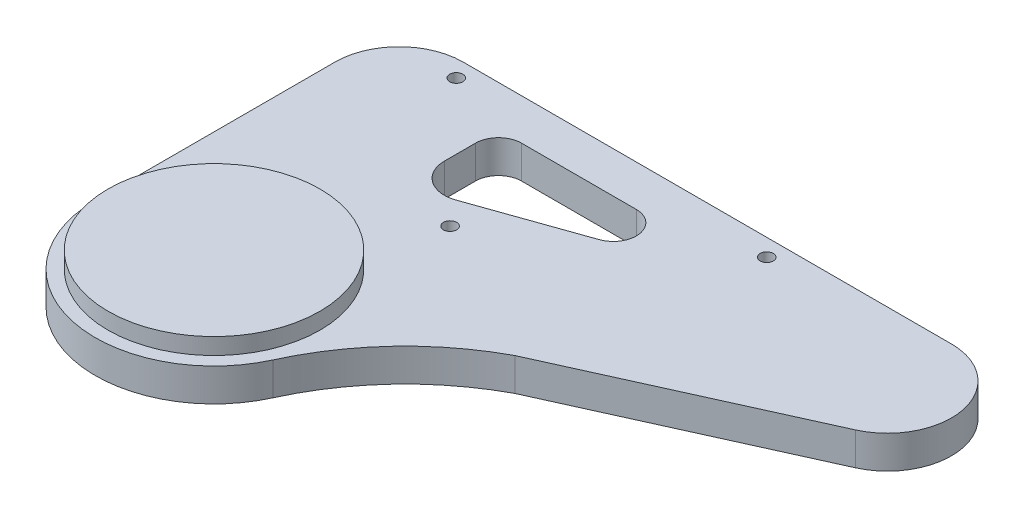
from build123d import *

# Parameters (mm, degrees)
SKETCH2_R           = 2
BOSS_EXTRUDE1_DEPTH = 10
SKETCH2_3_R         = 32.25
BOSS_EXTRUDE2_DEPTH = 5


with BuildPart() as part:
    # Sketch2 → Boss-Extrude1 (new body)
    with BuildSketch(Plane(origin=(0, 0, 0), x_dir=(1, 0, 0), z_dir=(0, 1, 0))):
        with BuildLine():
            Line((-168.164651686, 0), (-168.164651686, -73))
            ThreePointArc((-168.164651686, -73), (-139.674052468, -108.34106606), (-99.092179421, -87.998579142))
            ThreePointArc((-99.092179421, -87.998579142), (-84.378455589, -66.061963443), (-63.40890367, -50))
            Line((-63.40890367, -50), (8.019460447, -17.776215731))
            ThreePointArc((8.019460447, -17.776215731), (19.089691145, 3.986136419), (0.23577867, 19.5))
            Line((0.23577867, 19.5), (-148.664651686, 19.5))
            ThreePointArc((-148.664651686, 19.5), (-162.453233919, 13.788582233), (-168.164651686, 0))
        make_face()
        with Locations((-107.4, -25.75)):
            Circle(SKETCH2_R, mode=Mode.SUBTRACT)
        with Locations((-145.503297495, 14.25)):
            Circle(SKETCH2_R, mode=Mode.SUBTRACT)
        with BuildLine():
            Line((-125.4, -9.5), (-125.4, 0))
            ThreePointArc((-125.4, 0), (-123.349747468, 4.949747468), (-118.4, 7))
            Line((-118.4, 7), (-83.352457382, 7))
            ThreePointArc((-83.352457382, 7), (-76.542299164, 1.133670887), (-81.121681044, -6.600754354))
            Line((-81.121681044, -6.600754354), (-113.406447056, -17.987557998))
            ThreePointArc((-113.406447056, -17.987557998), (-121.59894333, -16.846494963), (-125.4, -9.5))
        make_face(mode=Mode.SUBTRACT)
        with Locations((-51.003297495, 14.25)):
            Circle(SKETCH2_R, mode=Mode.SUBTRACT)
    extrude(amount=-BOSS_EXTRUDE1_DEPTH)

    # Sketch2<3> → Boss-Extrude2 (add)
    with BuildSketch(Plane(origin=(0, 0, 0), x_dir=(1, 0, 0), z_dir=(0, 1, 0))):
        with Locations((-132, -73)):
            Circle(SKETCH2_3_R)
    extrude(amount=BOSS_EXTRUDE2_DEPTH)


solid = part.part
